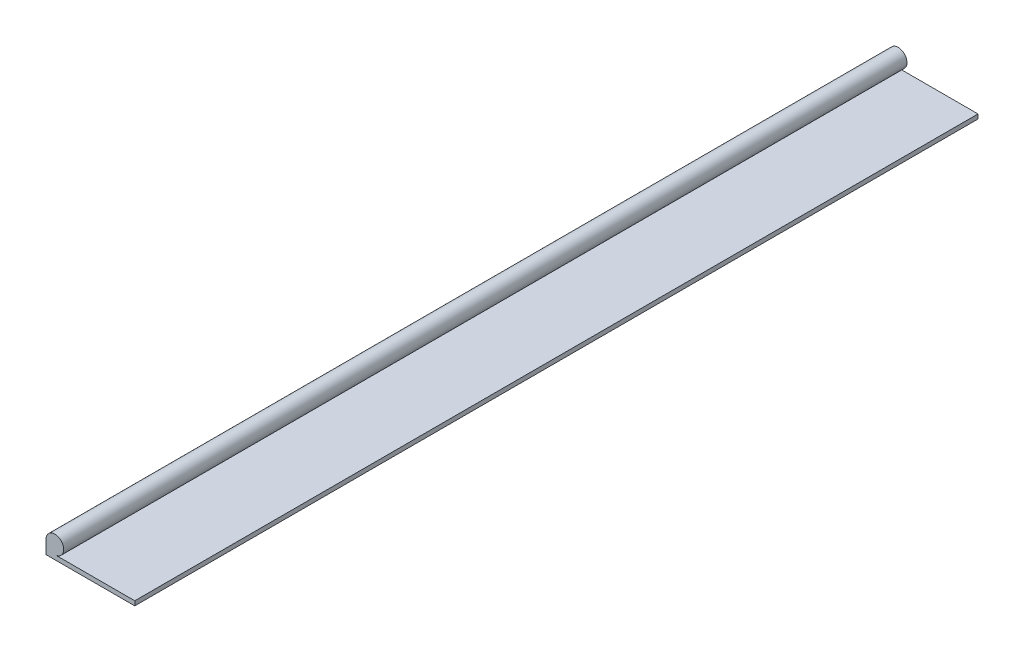
from build123d import *

# Parameters (mm, degrees)
BOSS_EXTRUDE2_DEPTH = 241.3


with BuildPart() as part:
    # Sketch1 → Boss-Extrude2 (new body)
    with BuildSketch(Plane.XY):
        with BuildLine():
            Line((-25.4, 1.27), (-25.4, 3.81))
            ThreePointArc((-25.4, 3.81), (-21.063948776, 5.606051224), (-22.86, 1.27))
            Line((-22.86, 1.27), (0, 1.27))
            Line((0, 1.27), (0, 0))
            Line((0, 0), (-25.4, 0))
            Line((-25.4, 0), (-25.4, 1.27))
        make_face()
    extrude(amount=BOSS_EXTRUDE2_DEPTH)


solid = part.part
